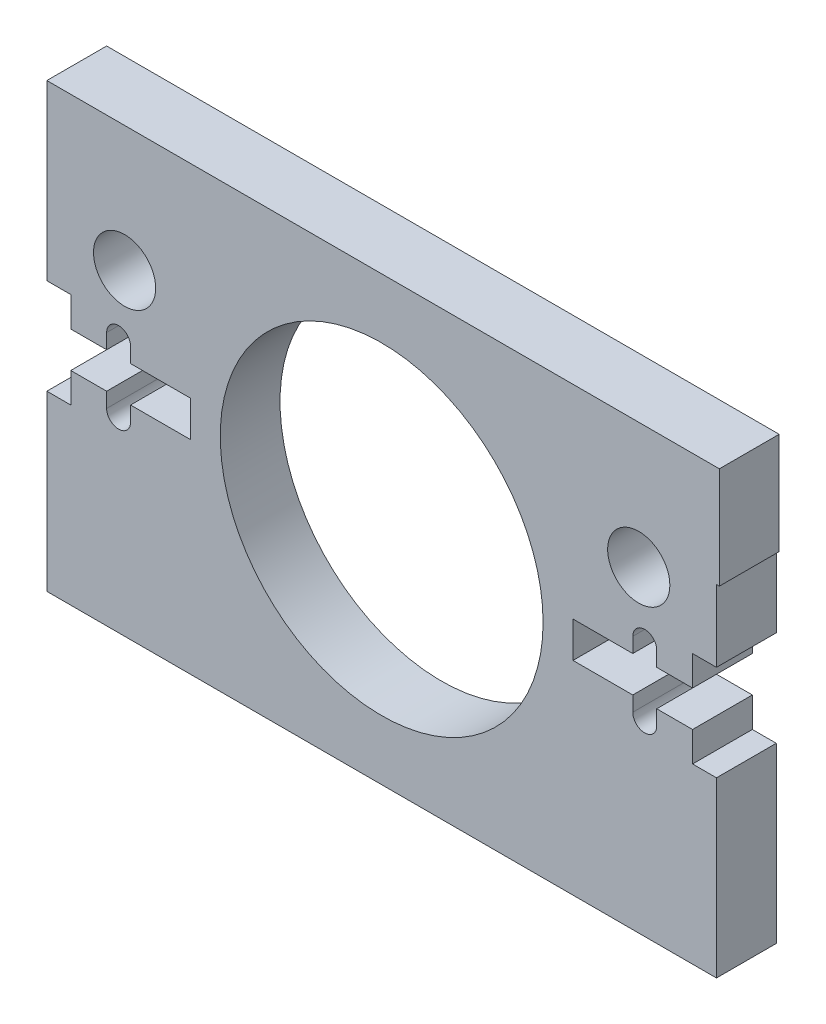
from build123d import *

# Parameters (mm, degrees)
SKETCH1_R           = 2.6
BOSS_EXTRUDE1_DEPTH = 5
SKETCH2_W           = 69.749863317
SKETCH2_H           = 53.464567198
SKETCH2_W_2         = 56
SKETCH2_H_2         = 33
SKETCH2_R           = 13.5
CUT_EXTRUDE1_DEPTH  = 10
BOSS_EXTRUDE2_DEPTH = 5


with BuildPart() as part:
    # Sketch1 → Boss-Extrude1 (new body)
    with BuildSketch(Plane.XY):
        with BuildLine():
            Line((-28, -18.201493875), (-28, -24.201493875))
            Line((-28, -24.201493875), (28, -24.201493875))
            Line((28, -24.201493875), (28, -18.201493875))
            Line((28, -18.201493875), (26, -18.201493875))
            Line((26, -18.201493875), (26, -15.701493875))
            Line((26, -15.701493875), (23, -15.701493875))
            Line((23, -15.701493875), (23, -16.951493875))
            ThreePointArc((23, -16.951493875), (22, -17.951493875), (21, -16.951493875))
            Line((21, -16.951493875), (21, -15.701493875))
            Line((21, -15.701493875), (16, -15.701493875))
            Line((16, -15.701493875), (16, -12.701493875))
            Line((16, -12.701493875), (21, -12.701493875))
            Line((21, -12.701493875), (21, -11.451493875))
            ThreePointArc((21, -11.451493875), (22, -10.451493875), (23, -11.451493875))
            Line((23, -11.451493875), (23, -12.701493875))
            Line((23, -12.701493875), (26, -12.701493875))
            Line((26, -12.701493875), (26, -10.201493875))
            Line((26, -10.201493875), (28, -10.201493875))
            Line((28, -10.201493875), (28, -4.201493875))
            Line((28, -4.201493875), (26, -4.201493875))
            Line((26, -4.201493875), (26, 2.924352213))
            Line((26, 2.924352213), (12, 17.426918513))
            Line((12, 17.426918513), (-12, 17.426918513))
            Line((-12, 17.426918513), (-26, 2.924352213))
            Line((-26, 2.924352213), (-26, -4.201493875))
            Line((-26, -4.201493875), (-28, -4.201493875))
            Line((-28, -4.201493875), (-28, -10.201493875))
            Line((-28, -10.201493875), (-26, -10.201493875))
            Line((-26, -10.201493875), (-26, -12.701493875))
            Line((-26, -12.701493875), (-23, -12.701493875))
            Line((-23, -12.701493875), (-23, -11.451493875))
            ThreePointArc((-23, -11.451493875), (-22, -10.451493875), (-21, -11.451493875))
            Line((-21, -11.451493875), (-21, -12.701493875))
            Line((-21, -12.701493875), (-16, -12.701493875))
            Line((-16, -12.701493875), (-16, -15.701493875))
            Line((-16, -15.701493875), (-21, -15.701493875))
            Line((-21, -15.701493875), (-21, -16.951493875))
            ThreePointArc((-21, -16.951493875), (-22, -17.951493875), (-23, -16.951493875))
            Line((-23, -16.951493875), (-23, -15.701493875))
            Line((-23, -15.701493875), (-26, -15.701493875))
            Line((-26, -15.701493875), (-26, -18.201493875))
            Line((-26, -18.201493875), (-28, -18.201493875))
        make_face()
        with Locations((-21.5, -6.201493875)):
            Circle(SKETCH1_R, mode=Mode.SUBTRACT)
        with Locations((21.5, -6.201493875)):
            Circle(SKETCH1_R, mode=Mode.SUBTRACT)
        with BuildLine():
            Line((8.25, 3.201632482), (8.25, -1.451493875))
            Line((8.25, -1.451493875), (3.596873642, -1.451493875))
            ThreePointArc((3.596873642, -1.451493875), (0, -2.201493875), (-3.596873642, -1.451493875))
            Line((-3.596873642, -1.451493875), (-8.25, -1.451493875))
            Line((-8.25, -1.451493875), (-8.25, 3.201632482))
            ThreePointArc((-8.25, 3.201632482), (-8.626766656, 4.233570052), (-8.875, 5.303723532))
            ThreePointArc((-8.875, 5.303723532), (-10.25, 6.798506125), (-8.875, 8.293288717))
            ThreePointArc((-8.875, 8.293288717), (-8.626766656, 9.363442197), (-8.25, 10.395379767))
            Line((-8.25, 10.395379767), (-8.25, 15.048506125))
            Line((-8.25, 15.048506125), (-3.596873642, 15.048506125))
            ThreePointArc((-3.596873642, 15.048506125), (0, 15.798506125), (3.596873642, 15.048506125))
            Line((3.596873642, 15.048506125), (8.25, 15.048506125))
            Line((8.25, 15.048506125), (8.25, 10.395379767))
            ThreePointArc((8.25, 10.395379767), (8.626766656, 9.363442197), (8.875, 8.293288717))
            ThreePointArc((8.875, 8.293288717), (10.25, 6.798506125), (8.875, 5.303723532))
            ThreePointArc((8.875, 5.303723532), (8.626766656, 4.233570052), (8.25, 3.201632482))
        make_face(mode=Mode.SUBTRACT)
    extrude(amount=BOSS_EXTRUDE1_DEPTH)

    # Sketch2 → Cut-Extrude1 (cut)
    # profile 1 of 2: a face of its own
    with BuildSketch(Plane.XY.offset(5)):
        with Locations((5.197554668, -6.913421349)):
            Rectangle(SKETCH2_W, SKETCH2_H)
        with Locations((0, -14.201493875)):
            Rectangle(SKETCH2_W_2, SKETCH2_H_2, mode=Mode.SUBTRACT)
    # profile 2 of 2: a face of its own
    with BuildSketch(Plane.XY.offset(5)):
        with Locations((0, -14.201493875)):
            Circle(SKETCH2_R)
    extrude(amount=-CUT_EXTRUDE1_DEPTH, mode=Mode.SUBTRACT)


with BuildPart() as cut_extrude1_piece_1:
    # of the separate pieces the step leaves, piece 1, a body of its own (cut_extrude1_pieces)
    add(part.part.solids().sort_by_distance((9.069178574, -24.201493875, 0))[0])



with BuildPart() as cut_extrude1_piece_2:
    # of the separate pieces the step leaves, piece 2, a body of its own (cut_extrude1_pieces)
    add(part.part.solids().sort_by_distance((-28, -18.201493875, 0))[0])


with BuildPart() as cut_extrude1_piece_1_1:
    add(cut_extrude1_piece_1.part)

    add(cut_extrude1_piece_2.part)  # Boss-Extrude2 merges Cut-Extrude1 piece 2
    # Sketch3 → Boss-Extrude2 (add)
    with BuildSketch(Plane(origin=(0, 0, 0), x_dir=(-1, 0, 0), z_dir=(0, 0, -1))):
        with BuildLine():
            Line((-26, -4.201493875), (-26, -0.701493875))
            Line((-26, -0.701493875), (-26, 2.298506125))
            Line((-26, 2.298506125), (-8.25, 2.298506125))
            Line((-8.25, 2.298506125), (-8.25, -0.701493875))
            Line((-8.25, -0.701493875), (-8.25, -1.451493875))
            Line((-8.25, -1.451493875), (-4.437059837, -1.451493875))
            ThreePointArc((-4.437059837, -1.451493875), (2.167902598, -0.876697505), (8.25, -3.515638739))
            Line((8.25, -3.515638739), (8.25, -0.701493875))
            Line((8.25, -0.701493875), (26, -0.701493875))
            Line((26, -0.701493875), (26, -4.201493875))
            Line((26, -4.201493875), (28, -4.201493875))
            Line((28, -4.201493875), (28, -0.701493875))
            Line((28, -0.701493875), (28, 4.298506125))
            Line((28, 4.298506125), (-28.241259843, 4.298506125))
            Line((-28.241259843, 4.298506125), (-28.241259843, -0.701493875))
            Line((-28.241259843, -0.701493875), (-28.241259843, -4.201493875))
            Line((-28.241259843, -4.201493875), (-28, -4.201493875))
            Line((-28, -4.201493875), (-26, -4.201493875))
        make_face()
        Polygon((28, -27.701493875), (0, -27.701493875), (-28, -27.701493875), (-28, -32.701493875), (28, -32.701493875), align=None)
        with BuildLine():
            Line((28, -24.201493875), (9.069178574, -24.201493875))
            ThreePointArc((9.069178574, -24.201493875), (4.860555524, -26.796135593), (0, -27.701493875))
            Line((0, -27.701493875), (28, -27.701493875))
            Line((28, -27.701493875), (28, -24.201493875))
        make_face()
        with BuildLine():
            ThreePointArc((0, -27.701493875), (-4.860555524, -26.796135593), (-9.069178574, -24.201493875))
            Line((-9.069178574, -24.201493875), (-28, -24.201493875))
            Line((-28, -24.201493875), (-28, -27.701493875))
            Line((-28, -27.701493875), (0, -27.701493875))
        make_face()
    extrude(amount=-BOSS_EXTRUDE2_DEPTH)


solid = cut_extrude1_piece_1_1.part
